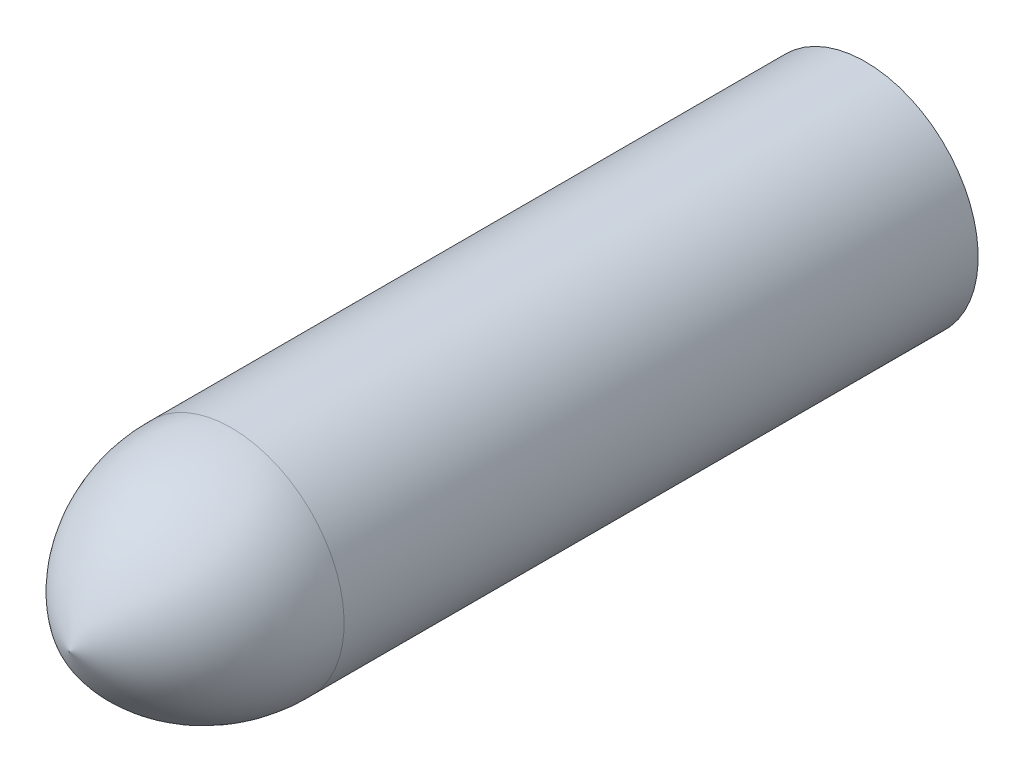
from build123d import *

# Parameters (mm, degrees)
SKETCH1_R           = 32
BOSS_EXTRUDE1_DEPTH = 180


with BuildPart() as part:
    # Sketch1 → Boss-Extrude1 (new body)
    with BuildSketch(Plane.XY):
        with Locations(Location((0, 0, 0), (0, 0, 180))):
            Circle(SKETCH1_R)
    extrude(amount=BOSS_EXTRUDE1_DEPTH)

    # Sketch2 → Revolve1 (revolve)
    with BuildSketch(Plane(origin=(0, 0, 0), x_dir=(0, 0, -1), z_dir=(1, 0, 0))):
        with BuildLine():
            Line((-180, 0), (-226, 0))
            ThreePointArc((-226, 0), (-208.15422789, -23.409202591), (-180, -32))
            Line((-180, -32), (-180, 0))
        make_face()
    revolve(axis=Axis((0, 0, 180), (0, 0, 1)))


solid = part.part
